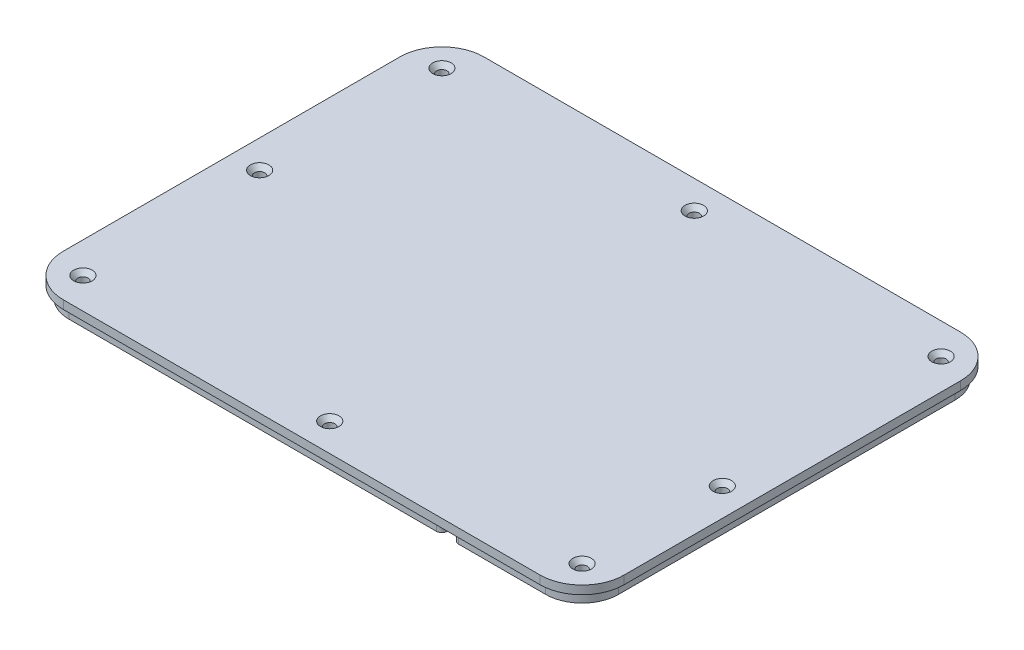
from build123d import *
from OCP.BRepFilletAPI import BRepFilletAPI_MakeChamfer

# Parameters (mm, degrees)
BASE_PLATE_DEPTH         = 3
INNER_START              = -3
INNER_BASE_PROFILE_DEPTH = 4
MOUNTING_START           = -7
BASEPLATE_5_R            = 1.83
MOUNTING_HOLES_DEPTH     = 7
COUNTERSINK_SIZE         = 1.7
COUNTERSINK_SIZE2        = 1.477787454


with BuildPart() as part:
    # BasePlate → Base Plate (new body)
    with BuildSketch(Plane(origin=(0, 0, 0), x_dir=(1, 0, 0), z_dir=(0, 1, 0))):
        with BuildLine():
            Line((-85, 75), (85, 75))
            ThreePointArc((85, 75), (95.606601718, 70.606601718), (100, 60))
            Line((100, 60), (100, -60))
            ThreePointArc((100, -60), (95.606601718, -70.606601718), (85, -75))
            Line((85, -75), (-85, -75))
            ThreePointArc((-85, -75), (-95.606601718, -70.606601718), (-100, -60))
            Line((-100, -60), (-100, 60))
            ThreePointArc((-100, 60), (-95.606601718, 70.606601718), (-85, 75))
        make_face()
    extrude(amount=-BASE_PLATE_DEPTH)

    # BasePlate<4> → Inner Base Profile (add)
    with BuildSketch(Plane(origin=(0, 0, 0), x_dir=(1, 0, 0), z_dir=(0, 1, 0)).offset(INNER_START)):
        with BuildLine():
            Line((-85, 73), (46, 73))
            ThreePointArc((46, 73), (47.414213562, 72.414213562), (48, 71))
            ThreePointArc((48, 71), (50, 69), (52, 71))
            ThreePointArc((52, 71), (52.585786438, 72.414213562), (54, 73))
            Line((54, 73), (85, 73))
            ThreePointArc((85, 73), (94.192388155, 69.192388155), (98, 60))
            Line((98, 60), (98, -60))
            ThreePointArc((98, -60), (94.192388155, -69.192388155), (85, -73))
            Line((85, -73), (54, -73))
            ThreePointArc((54, -73), (52.585786438, -72.414213562), (52, -71))
            ThreePointArc((52, -71), (50, -69), (48, -71))
            ThreePointArc((48, -71), (47.414213562, -72.414213562), (46, -73))
            Line((46, -73), (-85, -73))
            ThreePointArc((-85, -73), (-94.192388155, -69.192388155), (-98, -60))
            Line((-98, -60), (-98, 60))
            ThreePointArc((-98, 60), (-94.192388155, 69.192388155), (-85, 73))
        make_face()
    extrude(amount=-INNER_BASE_PROFILE_DEPTH)

    # BasePlate<5> → Mounting Holes (cut)
    with BuildSketch(Plane(origin=(0, 0, 0), x_dir=(1, 0, 0), z_dir=(0, 1, 0)).offset(MOUNTING_START)):
        with Locations(Location((90, -15, 0), (0, 0, 270))):
            Circle(BASEPLATE_5_R)
        with Locations(Location((-89, 64, 0), (0, 0, 270))):
            Circle(BASEPLATE_5_R)
        with Locations(Location((89, 64, 0), (0, 0, 270))):
            Circle(BASEPLATE_5_R)
        with Locations(Location((89, -64, 0), (0, 0, 270))):
            Circle(BASEPLATE_5_R)
        with Locations(Location((-89, -64, 0), (0, 0, 270))):
            Circle(BASEPLATE_5_R)
        with Locations(Location((0, 65, 0), (0, 0, 270))):
            Circle(BASEPLATE_5_R)
        with Locations(Location((-90, 0, 0), (0, 0, 270))):
            Circle(BASEPLATE_5_R)
        with Locations(Location((0, -65, 0), (0, 0, 270))):
            Circle(BASEPLATE_5_R)
    extrude(amount=MOUNTING_HOLES_DEPTH, mode=Mode.SUBTRACT)

    # Countersink: one chamfer whose edges measure the first distance from different faces: ONE call of the kernel's chamfer builder (chamfer() names one face for all edges)
    countersink_edges_1 = [part.edges().sort_by_distance(p)[0] for p in [
        (-89, 0, 62.17),
    ]]
    countersink_side_1 = [part.faces().sort_by_distance(p)[0] for p in [
        (-89, -3.5, 62.17),
    ]]
    countersink_edges_2 = [part.edges().sort_by_distance(p)[0] for p in [
        (0, 0, -66.83),
    ]]
    countersink_side_2 = [part.faces().sort_by_distance(p)[0] for p in [
        (0, -3.5, -66.83),
    ]]
    countersink_edges_3 = [part.edges().sort_by_distance(p)[0] for p in [
        (89, 0, -65.83),
    ]]
    countersink_side_3 = [part.faces().sort_by_distance(p)[0] for p in [
        (89, -3.5, -65.83),
    ]]
    countersink_edges_4 = [part.edges().sort_by_distance(p)[0] for p in [
        (90, 0, 13.17),
    ]]
    countersink_side_4 = [part.faces().sort_by_distance(p)[0] for p in [
        (90, -3.5, 13.17),
    ]]
    countersink_edges_5 = [part.edges().sort_by_distance(p)[0] for p in [
        (89, 0, 62.17),
    ]]
    countersink_side_5 = [part.faces().sort_by_distance(p)[0] for p in [
        (89, -3.5, 62.17),
    ]]
    countersink_edges_6 = [part.edges().sort_by_distance(p)[0] for p in [
        (-90, 0, -1.83),
    ]]
    countersink_side_6 = [part.faces().sort_by_distance(p)[0] for p in [
        (-90, -3.5, -1.83),
    ]]
    countersink_edges_7 = [part.edges().sort_by_distance(p)[0] for p in [
        (-89, 0, -65.83),
    ]]
    countersink_side_7 = [part.faces().sort_by_distance(p)[0] for p in [
        (-89, -3.5, -65.83),
    ]]
    countersink_edges_8 = [part.edges().sort_by_distance(p)[0] for p in [
        (0, 0, 63.17),
    ]]
    countersink_side_8 = [part.faces().sort_by_distance(p)[0] for p in [
        (0, -3.5, 63.17),
    ]]
    countersink = BRepFilletAPI_MakeChamfer(part.part.solid().wrapped)
    for e in countersink_edges_1:
        countersink.Add(COUNTERSINK_SIZE, COUNTERSINK_SIZE2, e.wrapped, countersink_side_1[0].wrapped)  # the first distance lies on this face
    for e in countersink_edges_2:
        countersink.Add(COUNTERSINK_SIZE, COUNTERSINK_SIZE2, e.wrapped, countersink_side_2[0].wrapped)  # the first distance lies on this face
    for e in countersink_edges_3:
        countersink.Add(COUNTERSINK_SIZE, COUNTERSINK_SIZE2, e.wrapped, countersink_side_3[0].wrapped)  # the first distance lies on this face
    for e in countersink_edges_4:
        countersink.Add(COUNTERSINK_SIZE, COUNTERSINK_SIZE2, e.wrapped, countersink_side_4[0].wrapped)  # the first distance lies on this face
    for e in countersink_edges_5:
        countersink.Add(COUNTERSINK_SIZE, COUNTERSINK_SIZE2, e.wrapped, countersink_side_5[0].wrapped)  # the first distance lies on this face
    for e in countersink_edges_6:
        countersink.Add(COUNTERSINK_SIZE, COUNTERSINK_SIZE2, e.wrapped, countersink_side_6[0].wrapped)  # the first distance lies on this face
    for e in countersink_edges_7:
        countersink.Add(COUNTERSINK_SIZE, COUNTERSINK_SIZE2, e.wrapped, countersink_side_7[0].wrapped)  # the first distance lies on this face
    for e in countersink_edges_8:
        countersink.Add(COUNTERSINK_SIZE, COUNTERSINK_SIZE2, e.wrapped, countersink_side_8[0].wrapped)  # the first distance lies on this face
    add(Compound.cast(countersink.Shape()), mode=Mode.REPLACE)


solid = part.part
